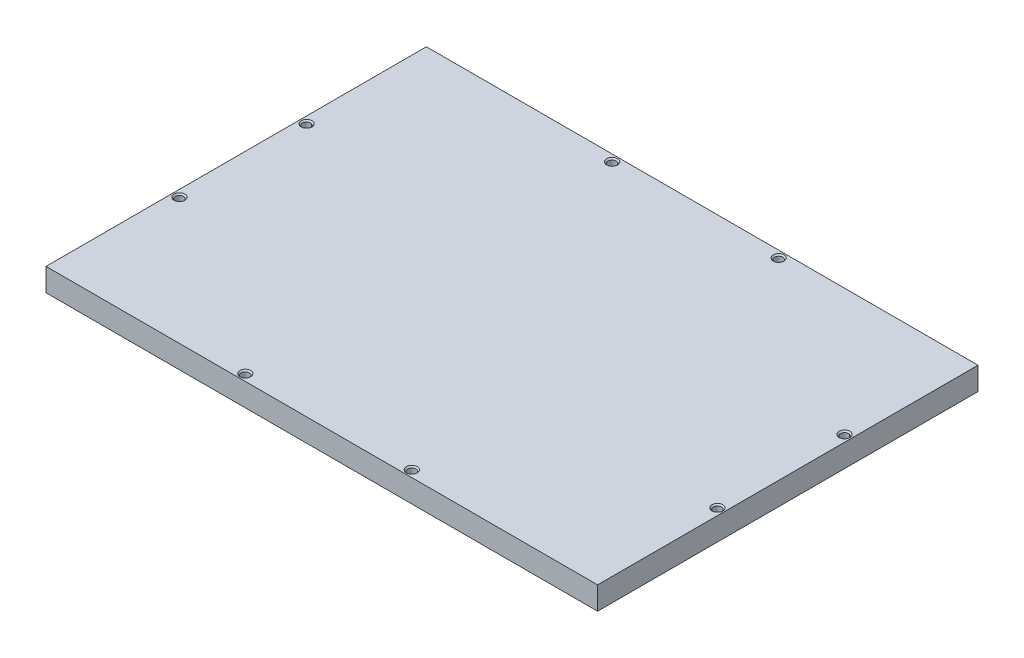
from build123d import *

# Parameters (mm, degrees)
SKETCH1_W                       = 257.81
SKETCH1_H                       = 177.8
BOSS_EXTRUDE1_DEPTH             = 10.687382177
F_6_CLEARANCE_HOLE1_D           = 3.7973
F_6_CLEARANCE_HOLE1_CSINK_D     = 5.0673
F_6_CLEARANCE_HOLE1_CSINK_ANGLE = 90


with BuildPart() as part:
    # Sketch1 → Boss-Extrude1 (new body)
    with BuildSketch(Plane(origin=(0, 0, 0), x_dir=(1, 0, 0), z_dir=(0, 1, 0))):
        with Locations((128.905, -88.9)):
            Rectangle(SKETCH1_W, SKETCH1_H)
    extrude(amount=BOSS_EXTRUDE1_DEPTH)

    # #6 Clearance Hole1 (through all)
    with Locations(Plane(origin=(0, 10.687382177, 0), x_dir=(1, 0, 0), z_dir=(0, 1, 0))):
        with Locations((3.175, -59.182), (89.9922, -3.175), (3.175, -118.618), (167.8178, -3.175), (254.635, -59.182), (254.635, -118.618), (167.8178, -174.625), (89.9922, -174.625)):
            CounterSinkHole(F_6_CLEARANCE_HOLE1_D / 2, F_6_CLEARANCE_HOLE1_CSINK_D / 2, counter_sink_angle=F_6_CLEARANCE_HOLE1_CSINK_ANGLE)


solid = part.part
